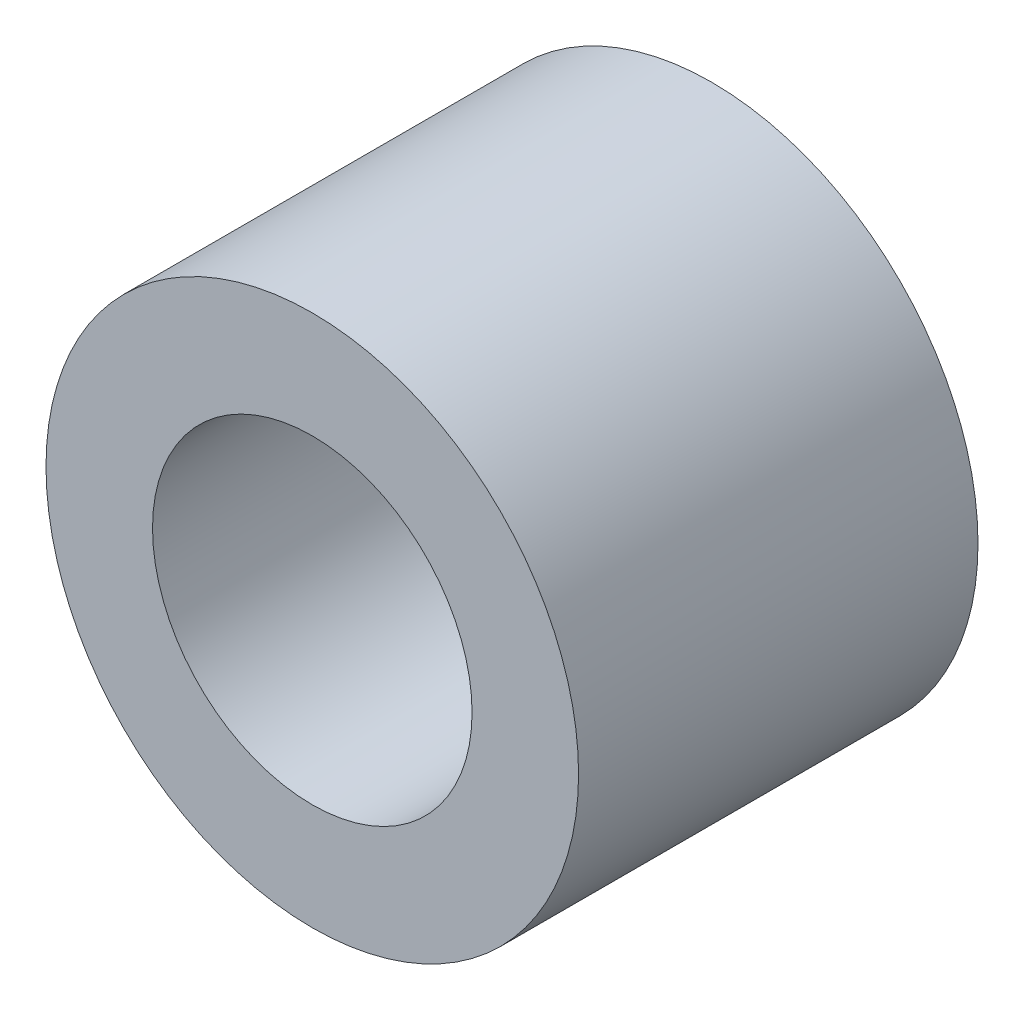
from build123d import *

# Parameters (mm, degrees)
SKETCH1_R           = 5
SKETCH1_R_2         = 3
BOSS_EXTRUDE1_DEPTH = 3.75
SKETCH2_R           = 3
BOSS_EXTRUDE2_DEPTH = 1.875


with BuildPart() as part:
    # Sketch1 → Boss-Extrude1 (new, symmetric)
    with BuildSketch(Plane.XY):
        Circle(SKETCH1_R)
        Circle(SKETCH1_R_2, mode=Mode.SUBTRACT)
    extrude(amount=BOSS_EXTRUDE1_DEPTH, both=True)

    # Sketch2 → Boss-Extrude2 (add)
    with BuildSketch(Plane(origin=(0, 0, -3.75), x_dir=(-1, 0, 0), z_dir=(0, 0, -1))):
        Circle(SKETCH2_R)
    extrude(amount=-BOSS_EXTRUDE2_DEPTH)


solid = part.part
